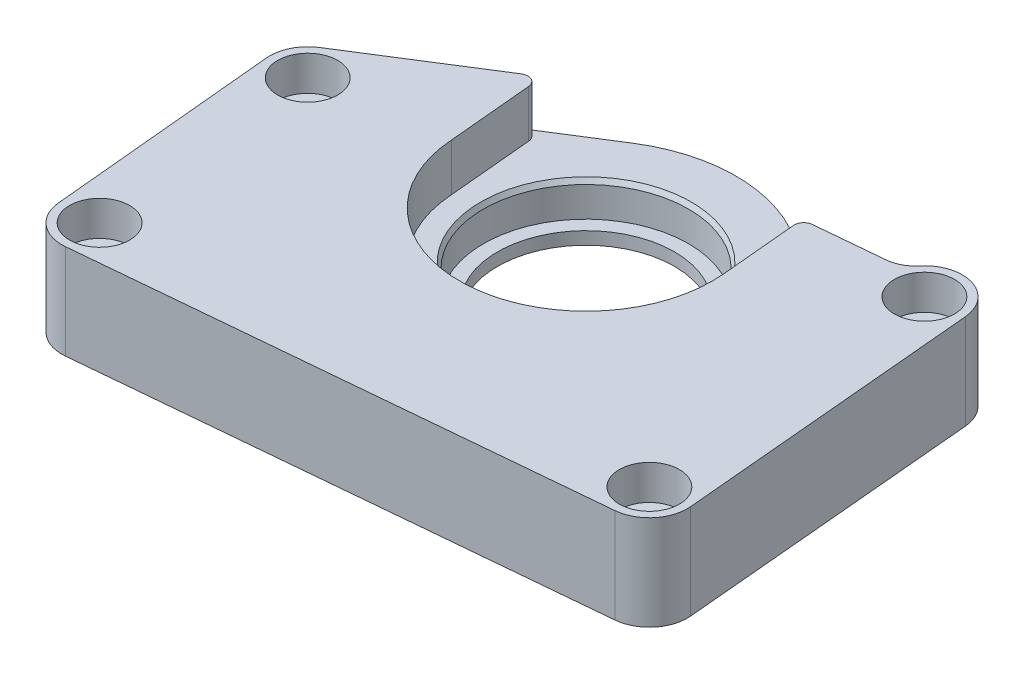
from build123d import *

# Parameters (mm, degrees)
SKETCH7_R               = 5.5
SKETCH7_R_2             = 28
MAIN_BODY_DEPTH         = 30
BOLT_HEAD_COUNTERSINK_R = 9.5
COUNTERSINK_HOLES_DEPTH = 11
SKETCH9_R               = 32.45
CUT_EXTRUDE2_DEPTH      = 26
CUT_EXTRUDE3_DEPTH      = 15
ROUND_EDGES_R           = 3
F_30_CHAMFER1_SIZE      = 1.5
F_30_CHAMFER1_SIZE2     = 0.866025404
SKETCH11_R              = 44.5
SKETCH11_R_2            = 38.5
SKETCH11_R_3            = 17.5
SKETCH11_R_4            = 11.5
SKETCH11_R_5            = 14
SKETCH11_R_6            = 8
CUT_EXTRUDE4_DEPTH      = 3


with BuildPart() as part:
    # Sketch7 → Main body (new body)
    with BuildSketch(Plane(origin=(0, 0, 0), x_dir=(1, 0, 0), z_dir=(0, 1, 0))):
        with BuildLine():
            Line((-91.813057025, -8.005811355), (-84.980564836, -80.685361783))
            ThreePointArc((-84.980564836, -80.685361783), (-80.697244338, -88.79601226), (-71.936363988, -91.511976387))
            Line((-71.936363988, -91.511976387), (87.393822743, -76.886943186))
            ThreePointArc((87.393822743, -76.886943186), (95.514657683, -72.620523346), (98.248872823, -63.864133341))
            Line((98.248872823, -63.864133341), (89.6645061, 31.751287215))
            ThreePointArc((89.6645061, 31.751287215), (81.254432476, 42.143635856), (68.448272489, 38.305340008))
            ThreePointArc((68.448272489, 38.305340008), (65.405823358, 35.822809296), (61.642082029, 34.703118865))
            Line((61.642082029, 34.703118865), (40.782608291, 32.788412667))
            ThreePointArc((40.782608291, 32.788412667), (36.543989689, 33.315359566), (32.911888119, 35.562891293))
            ThreePointArc((32.911888119, 35.562891293), (4.765471685, 48.687341482), (-25.474547855, 41.615342543))
            Line((-25.474547855, 41.615342543), (-86.26800446, 3.266768015))
            ThreePointArc((-86.26800446, 3.266768015), (-90.633494009, -1.585933038), (-91.813057025, -8.005811355))
        make_face()
        with Locations(Location((77.712578531, 30.678241374, 0), (0, 0, 270))):
            Circle(SKETCH7_R, mode=Mode.SUBTRACT)
        with Locations(Location((-79.865733667, -6.882661954, 0), (0, 0, 270))):
            Circle(SKETCH7_R, mode=Mode.SUBTRACT)
        with Locations(Location((86.296945253, -64.937179181, 0), (0, 0, 270))):
            Circle(SKETCH7_R, mode=Mode.SUBTRACT)
        with Locations(Location((-73.033241478, -79.562212382, 0), (0, 0, 270))):
            Circle(SKETCH7_R, mode=Mode.SUBTRACT)
        with Locations(Location((-0.132225968, 1.440515582, 0), (0, 0, 270))):
            Circle(SKETCH7_R_2, mode=Mode.SUBTRACT)
    extrude(amount=MAIN_BODY_DEPTH)

    # bolt head countersink → countersink holes (cut)
    with BuildSketch(Plane(origin=(0, 30, 0), x_dir=(1, 0, 0), z_dir=(0, 1, 0))):
        with Locations(Location((-79.865733667, -6.882661954, 0), (0, 0, 270))):
            Circle(BOLT_HEAD_COUNTERSINK_R)
        with Locations(Location((-73.033241478, -79.562212382, 0), (0, 0, 270))):
            Circle(BOLT_HEAD_COUNTERSINK_R)
        with Locations(Location((77.712578531, 30.678241374, 0), (0, 0, 270))):
            Circle(BOLT_HEAD_COUNTERSINK_R)
        with Locations(Location((86.296945253, -64.937179181, 0), (0, 0, 270))):
            Circle(BOLT_HEAD_COUNTERSINK_R)
    extrude(amount=-COUNTERSINK_HOLES_DEPTH, mode=Mode.SUBTRACT)

    # Sketch9 → Cut-Extrude2 (cut)
    with BuildSketch(Plane(origin=(0, 30, 0), x_dir=(1, 0, 0), z_dir=(0, 1, 0))):
        with Locations(Location((-0.132225968, 1.440515582, 0), (0, 0, 270))):
            Circle(SKETCH9_R)
    extrude(amount=-CUT_EXTRUDE2_DEPTH, mode=Mode.SUBTRACT)

    # Sketch10 → Cut-Extrude3 (cut)
    with BuildSketch(Plane(origin=(0, 30, 0), x_dir=(1, 0, 0), z_dir=(0, 1, 0))):
        with BuildLine():
            Line((-46.230998709, 66.050698395), (-40.039175854, -1.286268383))
            ThreePointArc((-40.039175854, -1.286268383), (3.059511975, -38.431941189), (39.700320715, 5.096773882))
            Line((39.700320715, 5.096773882), (33.434094657, 73.363214995))
            Line((33.434094657, 73.363214995), (-46.230998709, 66.050698395))
        make_face()
    extrude(amount=-CUT_EXTRUDE3_DEPTH, mode=Mode.SUBTRACT)

    # round edges
    round_edges_edges = [part.edges().sort_by_distance(p)[0] for p in [
        (-42.96933308, 22.5, -30.579614152),
        (37.127163098, 22.5, -33.12964587),
    ]]
    fillet(round_edges_edges, radius=ROUND_EDGES_R)

    # 30 Chamfer1
    f_30_chamfer1_edges = [part.edges().sort_by_distance(p)[0] for p in [
        (-0.132225968, 15, -33.890515582),
    ]]
    f_30_chamfer1_side = [part.faces().sort_by_distance(p)[0] for p in [
        (-0.132225968, 9.5, -33.890515582),
    ]]
    chamfer(f_30_chamfer1_edges, length=F_30_CHAMFER1_SIZE, length2=F_30_CHAMFER1_SIZE2, reference=f_30_chamfer1_side[0])

    # Sketch11 → Cut-Extrude4 (cut)
    # profile 1 of 3: a face of its own
    with BuildSketch(Plane.XZ):
        with Locations(Location((-0.132225968, -1.440515582, 0), (0, 0, 270))):
            Circle(SKETCH11_R)
        with Locations(Location((-0.132225968, -1.440515582, 0), (0, 0, 270))):
            Circle(SKETCH11_R_2, mode=Mode.SUBTRACT)
    # profile 2 of 3: a face of its own
    with BuildSketch(Plane.XZ):
        with Locations(Location((-54.514942776, 62.86283352, 0), (0, 0, 270))):
            Circle(SKETCH11_R_3)
        with Locations(Location((-54.514942776, 62.86283352, 0), (0, 0, 270))):
            Circle(SKETCH11_R_4, mode=Mode.SUBTRACT)
    # profile 3 of 3: a face of its own
    with BuildSketch(Plane.XZ):
        with Locations(Location((67.139628144, 30.48677163, 0), (0, 0, 270))):
            Circle(SKETCH11_R_5)
        with Locations(Location((67.139628144, 30.48677163, 0), (0, 0, 270))):
            Circle(SKETCH11_R_6, mode=Mode.SUBTRACT)
    extrude(amount=-CUT_EXTRUDE4_DEPTH, mode=Mode.SUBTRACT)


solid = part.part
